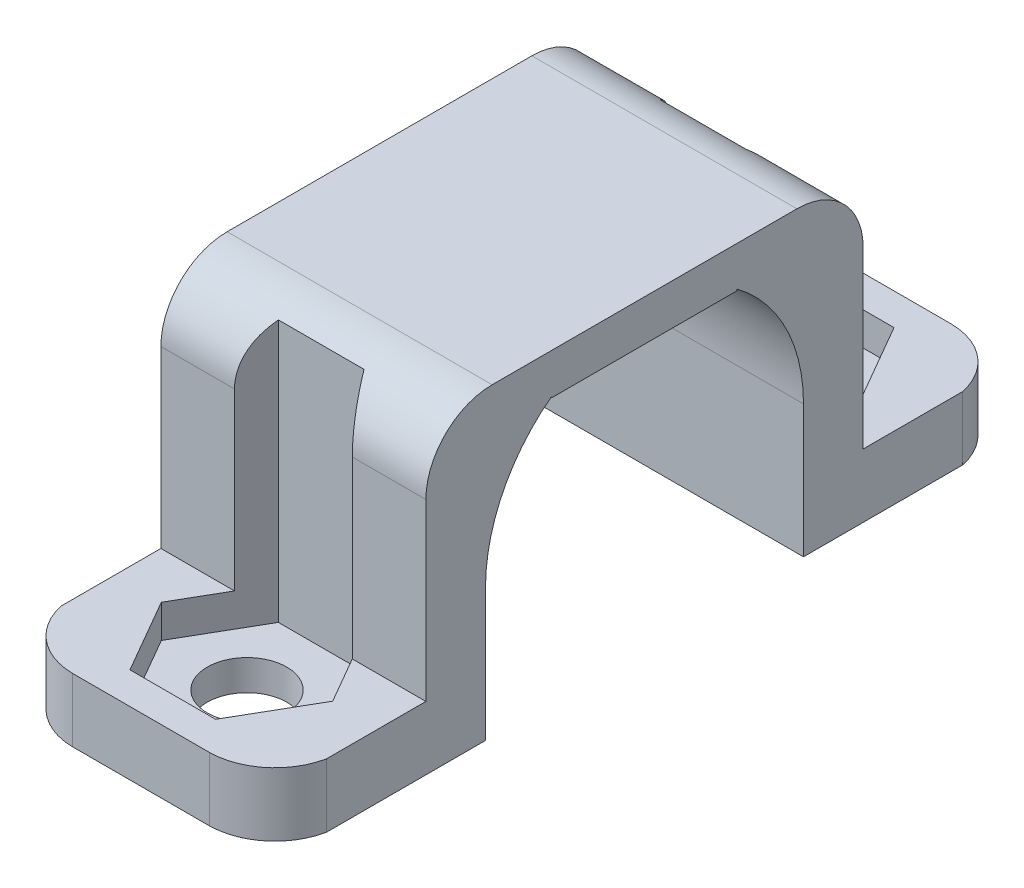
from build123d import *

# Parameters (mm, degrees)
BOSS_EXTRUDE1_DEPTH     = 10
CUT_EXTRUDE1_DEPTH      = 25
CUT_EXTRUDE1_DEPTH_BACK = 1.25
SKETCH2_R               = 1.5
CUT_EXTRUDE2_START      = -20
SKETCH6_R               = 1.5
CUT_EXTRUDE2_DEPTH      = 20


with BuildPart() as part:
    # Sketch1 → Boss-Extrude1 (new body)
    with BuildSketch(Plane(origin=(0, 0, 0), x_dir=(0, 0, -1), z_dir=(1, 0, 0))):
        with BuildLine():
            ThreePointArc((-5.414542326, 4.518432939), (-7.182309279, 3.786199892), (-7.914542326, 2.018432939))
            Line((-7.914542326, 2.018432939), (-7.914542326, -4.581567061))
            Line((-7.914542326, -4.581567061), (-13.664542326, -4.581567061))
            Line((-13.664542326, -4.581567061), (-13.664542326, -6.981567061))
            Line((-13.664542326, -6.981567061), (-5.664542326, -6.981567061))
            Line((-5.664542326, -6.981567061), (-5.664542326, -1.981567074))
            ThreePointArc((-5.664542326, -1.981567074), (-5.004712273, 0.813517905), (-3.164542326, 3.018432939))
            Line((-3.164542326, 3.018432939), (-3.164542326, 2.968432939))
            Line((-3.164542326, 2.968432939), (3.835457674, 2.968432939))
            Line((3.835457674, 2.968432939), (3.835457674, 3.018432939))
            ThreePointArc((3.835457674, 3.018432939), (5.675627611, 0.813517924), (6.335457674, -1.981567032))
            Line((6.335457674, -1.981567032), (6.335457674, -6.981567061))
            Line((6.335457674, -6.981567061), (14.335457674, -6.981567061))
            Line((14.335457674, -6.981567061), (14.335457674, -4.581567061))
            Line((14.335457674, -4.581567061), (8.585457674, -4.581567061))
            Line((8.585457674, -4.581567061), (8.585457674, 2.018432939))
            ThreePointArc((8.585457674, 2.018432939), (7.853224626, 3.786199892), (6.085457674, 4.518432939))
            Line((6.085457674, 4.518432939), (-5.414542326, 4.518432939))
        make_face()
    extrude(amount=BOSS_EXTRUDE1_DEPTH)

    # Sketch2 → Cut-Extrude1 (cut, two sides: drawn at the far end of the back side and taken through both)
    # profile 1 of 2: a face of its own
    with BuildSketch(Plane(origin=(0, -4.581567061, 0), x_dir=(1, 0, 0), z_dir=(0, 1, 0)).offset(-CUT_EXTRUDE1_DEPTH_BACK)):
        Polygon((8.233161507, 10.335457674), (6.616580754, 13.135457674), (3.383419246, 13.135457674), (1.766838493, 10.335457674), (3.383419246, 7.535457674), (6.616580754, 7.535457674), align=None)
        with Locations((5, 10.335457674)):
            Circle(SKETCH2_R, mode=Mode.SUBTRACT)
    # profile 2 of 2: a face of its own
    with BuildSketch(Plane(origin=(0, -4.581567061, 0), x_dir=(1, 0, 0), z_dir=(0, 1, 0)).offset(-CUT_EXTRUDE1_DEPTH_BACK)):
        Polygon((8.233161507, -9.664542326), (6.616580754, -6.864542326), (3.383419246, -6.864542326), (1.766838493, -9.664542326), (3.383419246, -12.464542326), (6.616580754, -12.464542326), align=None)
        with Locations((5, -9.664542326)):
            Circle(SKETCH2_R, mode=Mode.SUBTRACT)
    extrude(amount=CUT_EXTRUDE1_DEPTH + CUT_EXTRUDE1_DEPTH_BACK, mode=Mode.SUBTRACT)

    # Sketch6 → Cut-Extrude2 (cut)
    with BuildSketch(Plane(origin=(0, -4.581567061, 0), x_dir=(1, 0, 0), z_dir=(0, 1, 0)).offset(CUT_EXTRUDE2_START)):
        with BuildLine():
            Line((2.410452351, 14.335457674), (0, 14.335457674))
            Line((0, 14.335457674), (0, 12.338937423))
            ThreePointArc((0, 12.338937423), (0.854129864, 13.761085526), (2.410452351, 14.335457674))
        make_face()
        with BuildLine():
            Line((10, 14.335457674), (7.589547649, 14.335457674))
            ThreePointArc((7.589547649, 14.335457674), (9.145870136, 13.761085526), (10, 12.338937423))
            Line((10, 12.338937423), (10, 14.335457674))
        make_face()
        with BuildLine():
            ThreePointArc((2.410452351, -13.664542326), (0.854129864, -13.090170179), (0, -11.668022076))
            Line((0, -11.668022076), (0, -13.664542326))
            Line((0, -13.664542326), (2.410452351, -13.664542326))
        make_face()
        with BuildLine():
            Line((10, -13.664542326), (10, -11.668022076))
            ThreePointArc((10, -11.668022076), (9.145870136, -13.090170179), (7.589547649, -13.664542326))
            Line((7.589547649, -13.664542326), (10, -13.664542326))
        make_face()
        with Locations((5, 10.335457674)):
            Circle(SKETCH6_R)
        with Locations((5, -9.664542326)):
            Circle(SKETCH6_R)
    extrude(amount=CUT_EXTRUDE2_DEPTH, mode=Mode.SUBTRACT)


solid = part.part
